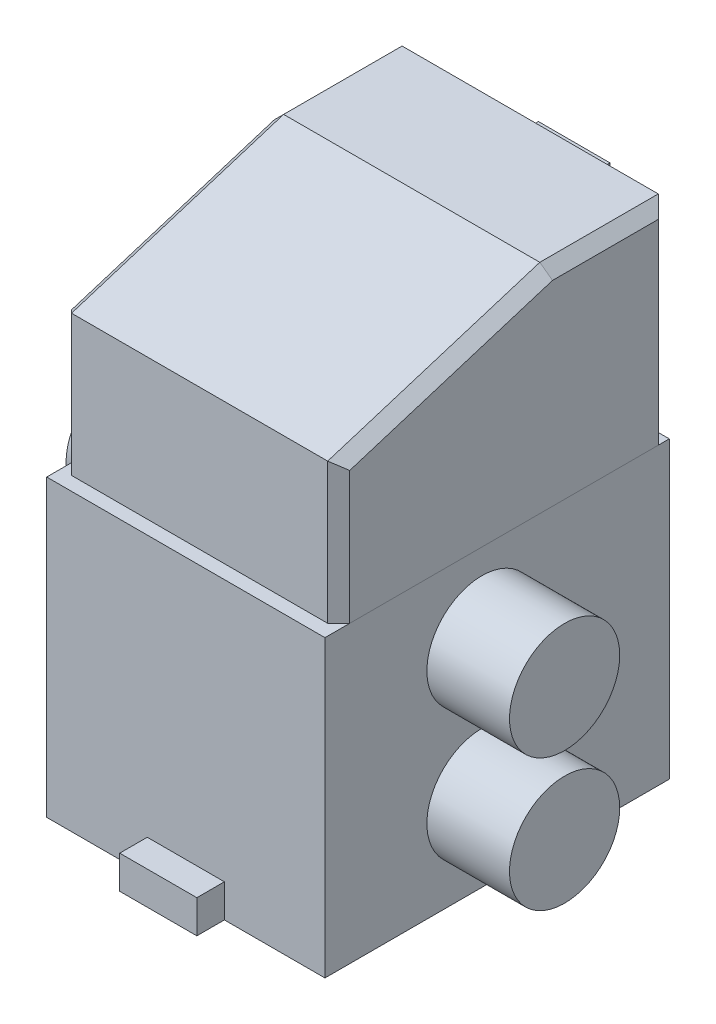
from build123d import *

# Parameters (mm, degrees)
SKETCH1_W             = 505
SKETCH1_H             = 535
BOSS_EXTRUDE1_DEPTH   = 625
SKETCH2_W             = 75
SKETCH2_H             = 60
BOSS_EXTRUDE2_DEPTH   = 70
SKETCH3_R             = 100
BOSS_EXTRUDE3_DEPTH   = 150
BOSS_EXTRUDE3_2_DEPTH = 150
BOSS_EXTRUDE3_3_DEPTH = 150
SKETCH4_R             = 100
BOSS_EXTRUDE4_DEPTH   = 150
BOSS_EXTRUDE4_2_DEPTH = 150
BOSS_EXTRUDE5_DEPTH   = 252.5
CHAMFER1_SIZE         = 20
SKETCH6_W             = 130
SKETCH6_H             = 130
BOSS_EXTRUDE6_DEPTH   = 80


with BuildPart() as part:
    # Sketch1 → Boss-Extrude1 (new body)
    with BuildSketch(Plane.XY):
        with Locations((0, 267.5)):
            Rectangle(SKETCH1_W, SKETCH1_H)
    extrude(amount=BOSS_EXTRUDE1_DEPTH)

    # Sketch2 → Boss-Extrude2 (add, symmetric)
    with BuildSketch(Plane(origin=(0, 0, 0), x_dir=(0, 0, -1), z_dir=(1, 0, 0))):
        with Locations((-637.5, 30)):
            Rectangle(SKETCH2_W, SKETCH2_H)
    extrude(amount=BOSS_EXTRUDE2_DEPTH, both=True)


with BuildPart() as body_2:
    # Sketch3 → Boss-Extrude3 (new body)
    with BuildSketch(Plane.ZY.offset(252.5)):
        with Locations((340, 390)):
            Circle(SKETCH3_R)
    extrude(amount=BOSS_EXTRUDE3_DEPTH)


with BuildPart() as body_3:
    # Sketch3 → Boss-Extrude3 2 (new body)
    with BuildSketch(Plane.ZY.offset(252.5)):
        with Locations((95, 190)):
            Circle(SKETCH3_R)
    extrude(amount=BOSS_EXTRUDE3_2_DEPTH)


with BuildPart() as body_4:
    # Sketch3 → Boss-Extrude3 3 (new body)
    with BuildSketch(Plane.ZY.offset(252.5)):
        with Locations((340, 150)):
            Circle(SKETCH3_R)
    extrude(amount=BOSS_EXTRUDE3_3_DEPTH)


with BuildPart() as body_5:
    # Sketch4 → Boss-Extrude4 (new body)
    with BuildSketch(Plane(origin=(252.5, 0, 0), x_dir=(0, 0, -1), z_dir=(1, 0, 0))):
        with Locations((-340, 390)):
            Circle(SKETCH4_R)
    extrude(amount=BOSS_EXTRUDE4_DEPTH)


with BuildPart() as body_6:
    # Sketch4 → Boss-Extrude4 2 (new body)
    with BuildSketch(Plane(origin=(252.5, 0, 0), x_dir=(0, 0, -1), z_dir=(1, 0, 0))):
        with Locations((-340, 150)):
            Circle(SKETCH4_R)
    extrude(amount=BOSS_EXTRUDE4_2_DEPTH)


with BuildPart() as body_7:
    # Sketch5 → Boss-Extrude5 (new, symmetric)
    with BuildSketch(Plane(origin=(0, 0, 0), x_dir=(0, 0, -1), z_dir=(1, 0, 0))):
        Polygon((-600, 790), (-600, 535), (0, 535), (0, 910), (-215, 910), align=None)
    extrude(amount=BOSS_EXTRUDE5_DEPTH, both=True)

    # Chamfer1
    chamfer1_edges = [body_7.edges().sort_by_distance(p)[0] for p in [
        (252.5, 722.5, 0),
        (252.5, 910, 107.5),
        (252.5, 850, 407.5),
        (-252.5, 910, 107.5),
        (-252.5, 722.5, 0),
        (-252.5, 662.5, 600),
        (-252.5, 850, 407.5),
        (252.5, 662.5, 600),
    ]]
    chamfer(chamfer1_edges, length=CHAMFER1_SIZE)

    # Sketch6 → Boss-Extrude6 (add)
    with BuildSketch(Plane(origin=(0, 0, 0), x_dir=(-1, 0, 0), z_dir=(0, 0, -1))):
        with Locations((0, 770)):
            Rectangle(SKETCH6_W, SKETCH6_H)
    extrude(amount=BOSS_EXTRUDE6_DEPTH)


solid = Compound([part.part, body_2.part, body_3.part, body_4.part, body_5.part, body_6.part, body_7.part])
